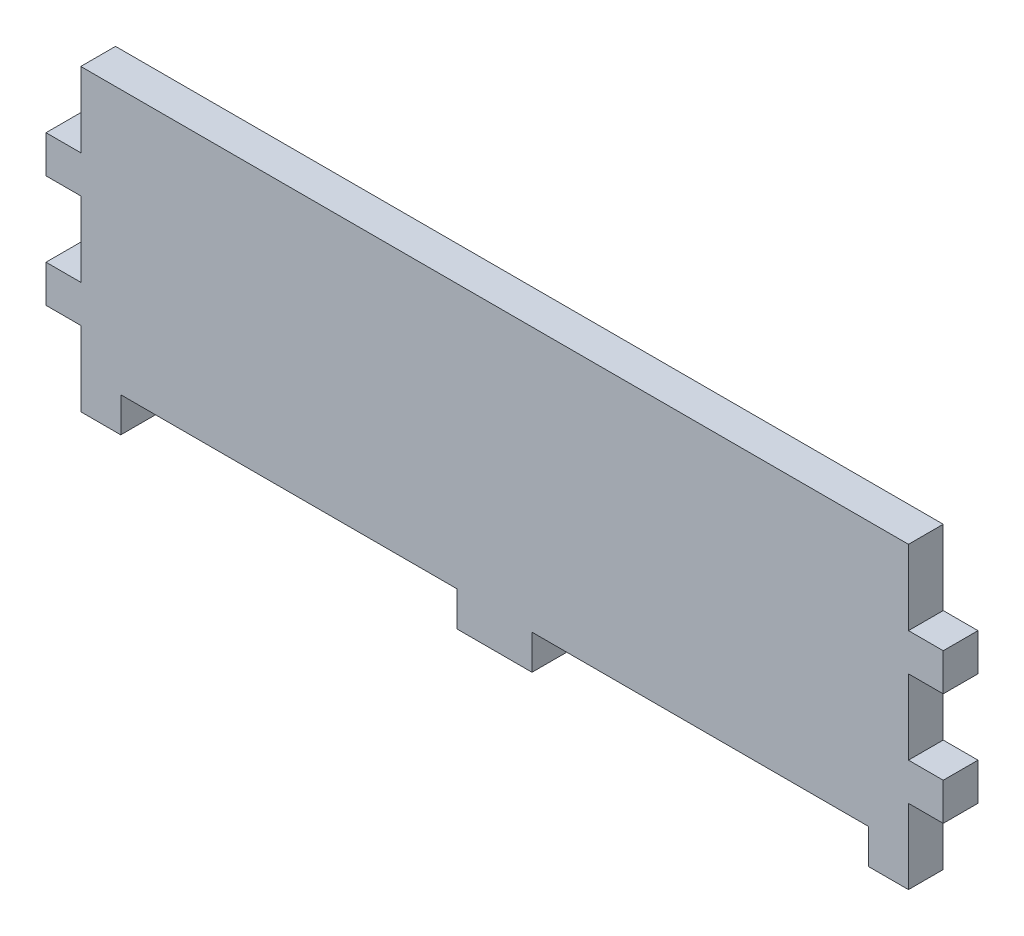
from build123d import *

# Parameters (mm, degrees)
BASE_SKETCH_W           = 304.8
BASE_SKETCH_H           = 89.79
BOSS_EXTRUDE1_DEPTH     = 11.81
JOINT_X_W               = 25.4
JOINT_X_H               = 11.81
BOSS_EXTRUDE2_DEPTH     = 11.81
JOINT_Y_W               = 11.81
JOINT_Y_H               = 25.4
CUT_EXTRUDE1_DEPTH      = 705.310070992
LPATTERN1_COUNT         = 3
LPATTERN1_PITCH         = 139.7
LPATTERN2_COUNT         = 3
LPATTERN2_PITCH         = 38.1
MIRROR1_COPY_1_SKETCH_W = 11.81
MIRROR1_COPY_1_SKETCH_H = 25.4
MIRROR1_COPY_1_DEPTH    = 705.310070992
MIRROR1_COPY_2_SKETCH_W = 11.81
MIRROR1_COPY_2_SKETCH_H = 25.4
MIRROR1_COPY_2_DEPTH    = 705.310070992


with BuildPart() as part:
    # Base_Sketch → Boss-Extrude1 (new body)
    with BuildSketch(Plane.XY):
        with Locations((-535.138681284, -95.622810132)):
            Rectangle(BASE_SKETCH_W, BASE_SKETCH_H)
    extrude(amount=BOSS_EXTRUDE1_DEPTH)

    # Joint_X → Boss-Extrude2 (add)
    with BuildSketch(Plane.XY.offset(11.81)):
        with Locations((-674.838681284, -146.422810132)):
            Rectangle(JOINT_X_W, JOINT_X_H)
    boss_extrude2 = extrude(amount=-BOSS_EXTRUDE2_DEPTH)

    # Joint_Y → Cut-Extrude1 (cut, through all)
    with BuildSketch(Plane.XY.offset(11.81)):
        with Locations((-681.633681284, -139.627810132)):
            Rectangle(JOINT_Y_W, JOINT_Y_H)
    cut_extrude1 = extrude(amount=-CUT_EXTRUDE1_DEPTH, mode=Mode.SUBTRACT)

    # LPattern1: Boss-Extrude2 ×3
    with Locations(*[(i * LPATTERN1_PITCH, 0, 0) for i in range(1, LPATTERN1_COUNT)]):
        add(boss_extrude2)

    # LPattern2: Cut-Extrude1 ×3
    with Locations(*[(0, i * LPATTERN2_PITCH, 0) for i in range(1, LPATTERN2_COUNT)]):
        add(cut_extrude1, mode=Mode.SUBTRACT)

    # Mirror1: Cut-Extrude1 across plane
    add(cut_extrude1.mirror(Plane.ZY.offset(535.138681284)), mode=Mode.SUBTRACT)

    # Mirror1 copy 1 sketch → Mirror1 copy 1 (cut, through all)
    with BuildSketch(Plane(origin=(-1070.277362567, 38.1, 11.81), x_dir=(-1, 0, 0), z_dir=(0, 0, 1))):
        with Locations((-681.633681284, 139.627810132)):
            Rectangle(MIRROR1_COPY_1_SKETCH_W, MIRROR1_COPY_1_SKETCH_H)
    extrude(amount=-MIRROR1_COPY_1_DEPTH, mode=Mode.SUBTRACT)

    # Mirror1 copy 2 sketch → Mirror1 copy 2 (cut, through all)
    with BuildSketch(Plane(origin=(-1070.277362567, 76.2, 11.81), x_dir=(-1, 0, 0), z_dir=(0, 0, 1))):
        with Locations((-681.633681284, 139.627810132)):
            Rectangle(MIRROR1_COPY_2_SKETCH_W, MIRROR1_COPY_2_SKETCH_H)
    extrude(amount=-MIRROR1_COPY_2_DEPTH, mode=Mode.SUBTRACT)


solid = part.part
